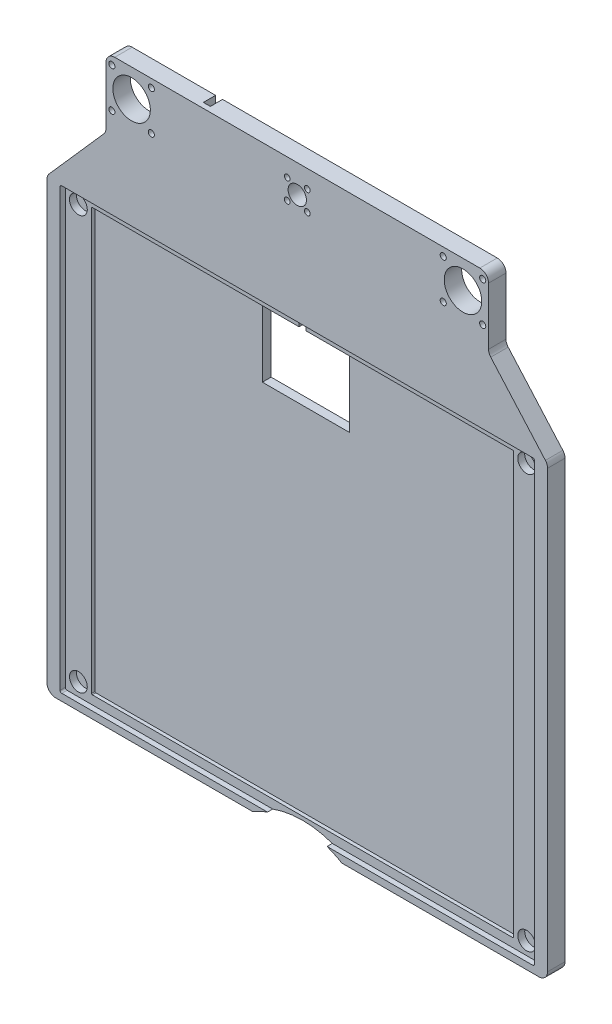
from build123d import *

# Parameters (mm, degrees)
MODEL_R                 = 10.75
MODEL_R_2               = 1.75
MODEL_R_3               = 5.25
MODEL_R_4               = 1.65
SALIENTE_EXTRUIR1_DEPTH = 10
CORTAR_EXTRUIR1_DEPTH   = 5
CORTAR_EXTRUIR2_DEPTH   = 3
CROQUIS3_R              = 5.1
CORTAR_EXTRUIR3_DEPTH   = 4
CORTAR_EXTRUIR4_REACH   = 307.225
CROQUIS4_R              = 50
CORTAR_EXTRUIR5_REACH   = 307.141


with BuildPart() as part:
    # Model → Saliente-Extruir1 (new body)
    with BuildSketch(Plane.XY):
        with BuildLine():
            Line((-155.7898, 91.0382), (-155.7898, 58.205145042))
            ThreePointArc((-155.7898, 58.205145042), (-156.112526651, 56.437911606), (-157.039045607, 54.898811501))
            Line((-157.039045607, 54.898811501), (-188.380554393, 19.344533541))
            ThreePointArc((-188.380554393, 19.344533541), (-189.307073349, 17.805433436), (-189.6298, 16.0382))
            Line((-189.6298, 16.0382), (-189.6298, -233.9618))
            ThreePointArc((-189.6298, -233.9618), (-188.165333906, -237.497333906), (-184.6298, -238.9618))
            Line((-184.6298, -238.9618), (92.3702, -238.9618))
            ThreePointArc((92.3702, -238.9618), (95.905733906, -237.497333906), (97.3702, -233.9618))
            Line((97.3702, -233.9618), (97.3702, 16.0382))
            ThreePointArc((97.3702, 16.0382), (97.047473349, 17.805433436), (96.120954393, 19.344533541))
            Line((96.120954393, 19.344533541), (64.779445607, 54.898811501))
            ThreePointArc((64.779445607, 54.898811501), (63.852926651, 56.437911606), (63.5302, 58.205145042))
            Line((63.5302, 58.205145042), (63.5302, 91.0382))
            ThreePointArc((63.5302, 91.0382), (62.065733906, 94.573733906), (58.5302, 96.0382))
            Line((58.5302, 96.0382), (-150.7898, 96.0382))
            ThreePointArc((-150.7898, 96.0382), (-154.325333906, 94.573733906), (-155.7898, 91.0382))
        make_face()
        with Locations((48.8702, 80.0382)):
            Circle(MODEL_R, mode=Mode.SUBTRACT)
        with Locations((37.5552, 68.7232)):
            Circle(MODEL_R_2, mode=Mode.SUBTRACT)
        with Locations((60.1852, 68.7232)):
            Circle(MODEL_R_2, mode=Mode.SUBTRACT)
        with Locations((60.1852, 91.3532)):
            Circle(MODEL_R_2, mode=Mode.SUBTRACT)
        with Locations((37.5552, 91.3532)):
            Circle(MODEL_R_2, mode=Mode.SUBTRACT)
        with Locations(Location((-129.8148, 91.3532, 0), (0, 0, 180))):
            Circle(MODEL_R_2, mode=Mode.SUBTRACT)
        with Locations(Location((-152.4448, 91.3532, 0), (0, 0, 180))):
            Circle(MODEL_R_2, mode=Mode.SUBTRACT)
        with Locations(Location((-152.4448, 68.7232, 0), (0, 0, 180))):
            Circle(MODEL_R_2, mode=Mode.SUBTRACT)
        with Locations(Location((-129.8148, 68.7232, 0), (0, 0, 180))):
            Circle(MODEL_R_2, mode=Mode.SUBTRACT)
        with Locations(Location((-141.1298, 80.0382, 0), (0, 0, 180))):
            Circle(MODEL_R, mode=Mode.SUBTRACT)
        with Locations((-46.1298, 80.0382)):
            Circle(MODEL_R_3, mode=Mode.SUBTRACT)
        with Locations((-51.8798, 85.7882)):
            Circle(MODEL_R_4, mode=Mode.SUBTRACT)
        with Locations((-40.3798, 85.7882)):
            Circle(MODEL_R_4, mode=Mode.SUBTRACT)
        with Locations((-40.3798, 74.2882)):
            Circle(MODEL_R_4, mode=Mode.SUBTRACT)
        with Locations((-51.8798, 74.2882)):
            Circle(MODEL_R_4, mode=Mode.SUBTRACT)
    extrude(amount=SALIENTE_EXTRUIR1_DEPTH)

    # Croquis1 → Cortar-Extruir1 (cut)
    with BuildSketch(Plane.XY.offset(10)):
        with BuildLine():
            Line((-167.1298, -229.4618), (-167.1298, 11.5382))
            ThreePointArc((-167.1298, 11.5382), (-166.983353391, 11.891753391), (-166.6298, 12.0382))
            Line((-166.6298, 12.0382), (74.3702, 12.0382))
            ThreePointArc((74.3702, 12.0382), (74.723753391, 11.891753391), (74.8702, 11.5382))
            Line((74.8702, 11.5382), (74.8702, -229.4618))
            ThreePointArc((74.8702, -229.4618), (74.723753391, -229.815353391), (74.3702, -229.9618))
            Line((74.3702, -229.9618), (-166.6298, -229.9618))
            ThreePointArc((-166.6298, -229.9618), (-166.983353391, -229.815353391), (-167.1298, -229.4618))
        make_face()
    extrude(amount=-CORTAR_EXTRUIR1_DEPTH, mode=Mode.SUBTRACT)

    # Croquis2 → Cortar-Extruir2 (cut)
    with BuildSketch(Plane.XY.offset(10)):
        with BuildLine():
            Line((-182.1298, -233.9618), (-182.1298, 16.0382))
            ThreePointArc((-182.1298, 16.0382), (-181.836906781, 16.745306781), (-181.1298, 17.0382))
            Line((-181.1298, 17.0382), (88.8702, 17.0382))
            ThreePointArc((88.8702, 17.0382), (89.577306781, 16.745306781), (89.8702, 16.0382))
            Line((89.8702, 16.0382), (89.8702, -233.9618))
            ThreePointArc((89.8702, -233.9618), (89.577306781, -234.668906781), (88.8702, -234.9618))
            Line((88.8702, -234.9618), (-181.1298, -234.9618))
            ThreePointArc((-181.1298, -234.9618), (-181.836906781, -234.668906781), (-182.1298, -233.9618))
        make_face()
    extrude(amount=-CORTAR_EXTRUIR2_DEPTH, mode=Mode.SUBTRACT)

    # Croquis3 → Cortar-Extruir3 (cut)
    with BuildSketch(Plane.XY.offset(7)):
        with Locations((-174.6298, -227.4618)):
            Circle(CROQUIS3_R)
        with Locations(Location((82.3702, -227.4618, 0), (0, 0, 180))):
            Circle(CROQUIS3_R)
        with Locations(Location((-174.6298, 9.5382, 0), (0, 0, 180))):
            Circle(CROQUIS3_R)
        with Locations((82.3702, 9.5382)):
            Circle(CROQUIS3_R)
    extrude(amount=-CORTAR_EXTRUIR3_DEPTH, mode=Mode.SUBTRACT)

    # Croquis4 → Cortar-Extruir4 (cut, up to next)
    with BuildSketch(Plane(origin=(0, 0, 0), x_dir=(-1, 0, 0), z_dir=(0, 0, -1)), mode=Mode.PRIVATE) as cortar_extruir4_sk1:
        with Locations((46.1298, -281.9618)):
            Circle(CROQUIS4_R)
    cortar_extruir4_tool1 = extrude(cortar_extruir4_sk1.sketch, amount=-CORTAR_EXTRUIR4_REACH, mode=Mode.PRIVATE) & part.part
    add(cortar_extruir4_tool1.solids().sort_by_distance((-46.1298, -281.9618, 0))[0], mode=Mode.SUBTRACT)

    # Croquis5 → Cortar-Extruir5 (cut, up to next)
    with BuildSketch(Plane.XY.offset(7), mode=Mode.PRIVATE) as cortar_extruir5_sk1:
        with BuildLine():
            Line((-71.1298, -27.9618), (-71.1298, 12.0382))
            Line((-71.1298, 12.0382), (-48.1298, 12.0382))
            Line((-48.1298, 12.0382), (-48.1298, 33.205145042))
            ThreePointArc((-48.1298, 33.205145042), (-54.866344033, 49.468601009), (-71.1298, 56.205145042))
            Line((-71.1298, 56.205145042), (-75.9598, 56.205145042))
            ThreePointArc((-75.9598, 56.205145042), (-95.051683092, 64.11326195), (-102.9598, 83.205145042))
            Line((-102.9598, 83.205145042), (-102.9598, 96.0382))
            Line((-102.9598, 96.0382), (-98.9598, 96.0382))
            Line((-98.9598, 96.0382), (-98.9598, 83.205145042))
            ThreePointArc((-98.9598, 83.205145042), (-92.223255967, 66.941689074), (-75.9598, 60.205145042))
            Line((-75.9598, 60.205145042), (-71.1298, 60.205145042))
            ThreePointArc((-71.1298, 60.205145042), (-52.037916908, 52.297028134), (-44.1298, 33.205145042))
            Line((-44.1298, 33.205145042), (-44.1298, 12.0382))
            Line((-44.1298, 12.0382), (-21.1298, 12.0382))
            Line((-21.1298, 12.0382), (-21.1298, -27.9618))
            Line((-21.1298, -27.9618), (-71.1298, -27.9618))
        make_face()
    cortar_extruir5_tool1 = extrude(cortar_extruir5_sk1.sketch, amount=-CORTAR_EXTRUIR5_REACH, mode=Mode.PRIVATE) & part.part
    add(cortar_extruir5_tool1.solids().sort_by_distance((-50.971663, 4.050415, 7))[0], mode=Mode.SUBTRACT)


solid = part.part
